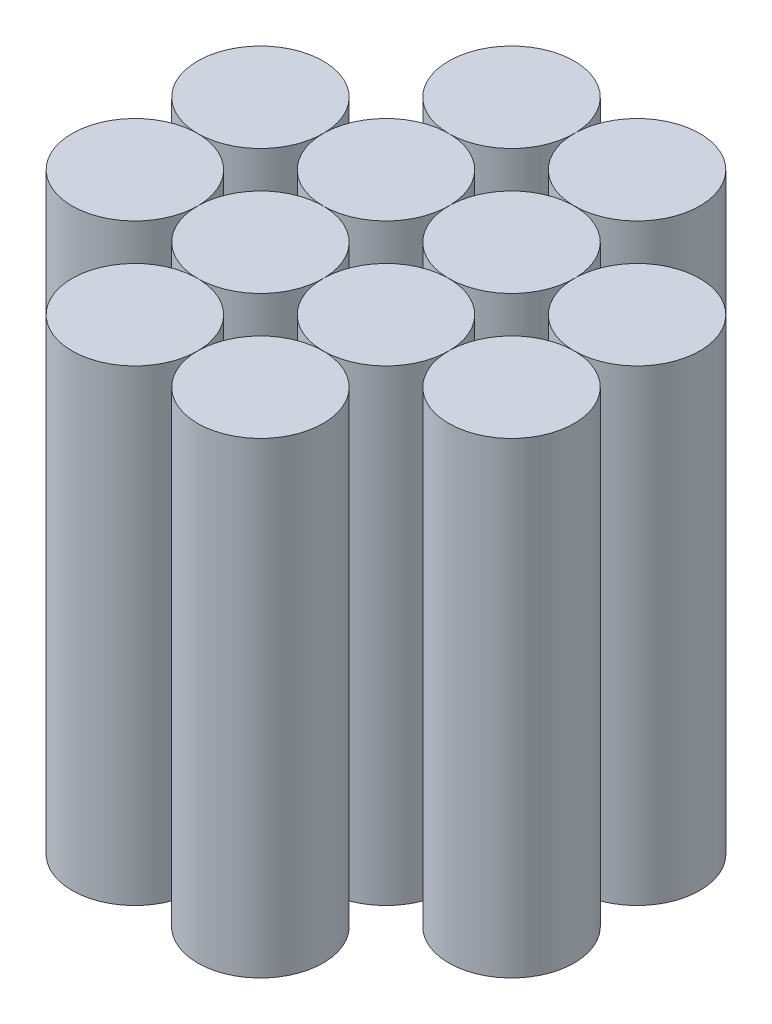
from build123d import *

# Parameters (mm, degrees)
BOSS_EXTRUDE1_DEPTH    = 67
BOSS_EXTRUDE1_2_DEPTH  = 67
BOSS_EXTRUDE1_3_DEPTH  = 67
BOSS_EXTRUDE1_4_DEPTH  = 67
BOSS_EXTRUDE1_5_DEPTH  = 67
BOSS_EXTRUDE1_6_DEPTH  = 67
BOSS_EXTRUDE1_7_DEPTH  = 67
BOSS_EXTRUDE1_8_DEPTH  = 67
BOSS_EXTRUDE1_9_DEPTH  = 67
BOSS_EXTRUDE1_10_DEPTH = 67
BOSS_EXTRUDE1_11_DEPTH = 67
BOSS_EXTRUDE1_12_DEPTH = 67


with BuildPart() as part:
    # Sketch1 → Boss-Extrude1 (new body)
    with BuildSketch(Plane(origin=(0, 0, 0), x_dir=(1, 0, 0), z_dir=(0, 1, 0))):
        with BuildLine():
            ThreePointArc((-18, -9), (-11.636038969, -6.363961031), (-9, 0))
            ThreePointArc((-9, 0), (-24.363961031, 6.363961031), (-18, -9))
        make_face()
    extrude(amount=BOSS_EXTRUDE1_DEPTH)


with BuildPart() as body_2:
    # Sketch1 → Boss-Extrude1 2 (new body)
    with BuildSketch(Plane(origin=(0, 0, 0), x_dir=(1, 0, 0), z_dir=(0, 1, 0))):
        with BuildLine():
            ThreePointArc((2.3e-08, 9), (-6.363961022, 6.363961039), (-9, 0))
            ThreePointArc((-9, 0), (-6.363961031, -6.363961031), (0, -9))
            ThreePointArc((0, -9), (6.363961031, -6.363961031), (9, 0))
            ThreePointArc((9, 0), (6.363961039, 6.363961022), (2.3e-08, 9))
        make_face()
    extrude(amount=BOSS_EXTRUDE1_2_DEPTH)


with BuildPart() as body_3:
    # Sketch1 → Boss-Extrude1 3 (new body)
    with BuildSketch(Plane(origin=(0, 0, 0), x_dir=(1, 0, 0), z_dir=(0, 1, 0))):
        with BuildLine():
            ThreePointArc((-9, -18), (-11.636038969, -11.636038969), (-18, -9))
            ThreePointArc((-18, -9), (-24.363961031, -24.363961031), (-9, -18))
        make_face()
    extrude(amount=BOSS_EXTRUDE1_3_DEPTH)


with BuildPart() as body_4:
    # Sketch1 → Boss-Extrude1 4 (new body)
    with BuildSketch(Plane(origin=(0, 0, 0), x_dir=(1, 0, 0), z_dir=(0, 1, 0))):
        with BuildLine():
            ThreePointArc((9, 18), (-6.363961039, 24.363961022), (2.3e-08, 9))
            ThreePointArc((2.3e-08, 9), (6.363961039, 11.636038978), (9, 18))
        make_face()
    extrude(amount=BOSS_EXTRUDE1_4_DEPTH)


with BuildPart() as body_5:
    # Sketch1 → Boss-Extrude1 5 (new body)
    with BuildSketch(Plane(origin=(0, 0, 0), x_dir=(1, 0, 0), z_dir=(0, 1, 0))):
        with BuildLine():
            ThreePointArc((9, -18), (6.363961031, -11.636038969), (0, -9))
            ThreePointArc((0, -9), (-6.363961031, -11.636038969), (-9, -18))
            ThreePointArc((-9, -18), (-6.363961047, -24.363961014), (-4.7e-08, -27))
            ThreePointArc((-4.7e-08, -27), (6.363961014, -24.363961047), (9, -18))
        make_face()
    extrude(amount=BOSS_EXTRUDE1_5_DEPTH)


with BuildPart() as body_6:
    # Sketch1 → Boss-Extrude1 6 (new body)
    with BuildSketch(Plane(origin=(0, 0, 0), x_dir=(1, 0, 0), z_dir=(0, 1, 0))):
        with BuildLine():
            ThreePointArc((18, 9), (24.363961031, 24.363961031), (9, 18))
            ThreePointArc((9, 18), (11.636038969, 11.636038969), (18, 9))
        make_face()
    extrude(amount=BOSS_EXTRUDE1_6_DEPTH)


with BuildPart() as body_7:
    # Sketch1 → Boss-Extrude1 7 (new body)
    with BuildSketch(Plane(origin=(0, 0, 0), x_dir=(1, 0, 0), z_dir=(0, 1, 0))):
        with BuildLine():
            ThreePointArc((18, 9), (11.636038969, 6.363961031), (9, 0))
            ThreePointArc((9, 0), (11.636038969, -6.363961031), (18, -9))
            ThreePointArc((18, -9), (24.363961031, -6.363961031), (27, 0))
            ThreePointArc((27, 0), (24.363961031, 6.363961031), (18, 9))
        make_face()
    extrude(amount=BOSS_EXTRUDE1_7_DEPTH)


with BuildPart() as body_8:
    # Sketch1 → Boss-Extrude1 8 (new body)
    with BuildSketch(Plane(origin=(0, 0, 0), x_dir=(1, 0, 0), z_dir=(0, 1, 0))):
        with BuildLine():
            ThreePointArc((18, -9), (11.636038969, -11.636038969), (9, -18))
            ThreePointArc((9, -18), (11.636038969, -24.363961031), (18, -27))
            ThreePointArc((18, -27), (24.363961031, -24.363961031), (27, -18))
            ThreePointArc((27, -18), (24.363961031, -11.636038969), (18, -9))
        make_face()
    extrude(amount=BOSS_EXTRUDE1_8_DEPTH)


with BuildPart() as body_9:
    # Sketch1 → Boss-Extrude1 9 (new body)
    with BuildSketch(Plane(origin=(0, 0, 0), x_dir=(1, 0, 0), z_dir=(0, 1, 0))):
        with BuildLine():
            ThreePointArc((9, -36), (6.363961014, -29.636038953), (-4.7e-08, -27))
            ThreePointArc((-4.7e-08, -27), (-6.363961014, -42.363961047), (9, -36))
        make_face()
    extrude(amount=BOSS_EXTRUDE1_9_DEPTH)


with BuildPart() as body_10:
    # Sketch1 → Boss-Extrude1 10 (new body)
    with BuildSketch(Plane(origin=(0, 0, 0), x_dir=(1, 0, 0), z_dir=(0, 1, 0))):
        with BuildLine():
            ThreePointArc((9, -36), (24.363961031, -42.363961031), (18, -27))
            ThreePointArc((18, -27), (11.636038969, -29.636038969), (9, -36))
        make_face()
    extrude(amount=BOSS_EXTRUDE1_10_DEPTH)


with BuildPart() as body_11:
    # Sketch1 → Boss-Extrude1 11 (new body)
    with BuildSketch(Plane(origin=(0, 0, 0), x_dir=(1, 0, 0), z_dir=(0, 1, 0))):
        with BuildLine():
            ThreePointArc((36, -9), (42.363961031, 6.363961031), (27, 0))
            ThreePointArc((27, 0), (29.636038969, -6.363961031), (36, -9))
        make_face()
    extrude(amount=BOSS_EXTRUDE1_11_DEPTH)


with BuildPart() as body_12:
    # Sketch1 → Boss-Extrude1 12 (new body)
    with BuildSketch(Plane(origin=(0, 0, 0), x_dir=(1, 0, 0), z_dir=(0, 1, 0))):
        with BuildLine():
            ThreePointArc((36, -9), (29.636038969, -11.636038969), (27, -18))
            ThreePointArc((27, -18), (42.363961031, -24.363961031), (36, -9))
        make_face()
    extrude(amount=BOSS_EXTRUDE1_12_DEPTH)


solid = Compound([part.part, body_2.part, body_3.part, body_4.part, body_5.part, body_6.part, body_7.part, body_8.part, body_9.part, body_10.part, body_11.part, body_12.part])
